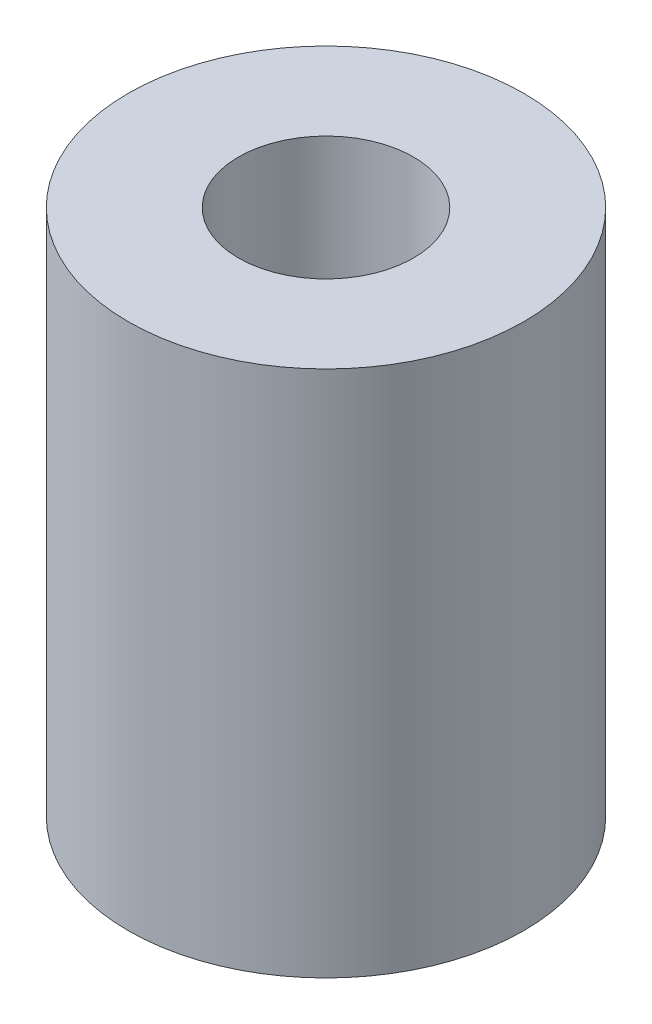
from build123d import *

# Parameters (mm, degrees)
SKETCH1_R           = 4.7625
SKETCH1_R_2         = 2.1082
BOSS_EXTRUDE1_DEPTH = 12.7


with BuildPart() as part:
    # Sketch1 → Boss-Extrude1 (new body)
    with BuildSketch(Plane(origin=(0, 0, 0), x_dir=(1, 0, 0), z_dir=(0, 1, 0))):
        with Locations(Location((0, 0, 0), (0, 0, 270))):
            Circle(SKETCH1_R)
        with Locations(Location((0, 0, 0), (0, 0, 270))):
            Circle(SKETCH1_R_2, mode=Mode.SUBTRACT)
    extrude(amount=BOSS_EXTRUDE1_DEPTH)


solid = part.part
